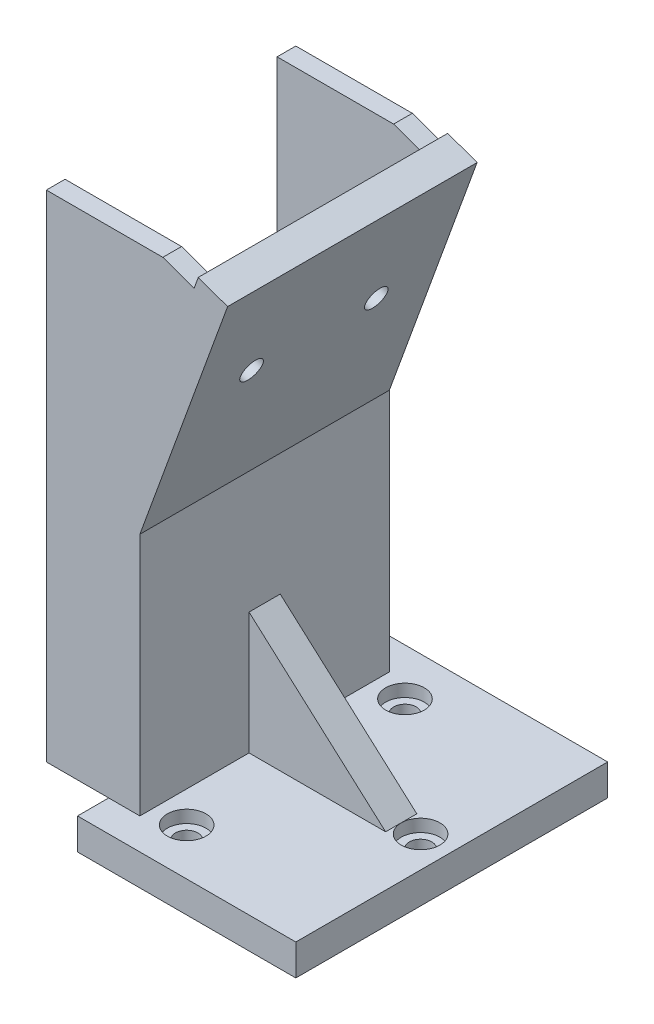
from build123d import *

# Parameters (mm, degrees)
SKETCH_2_W          = 5
SKETCH_2_H          = 40
CUT_EXTRUDE_1_REACH = 90.301
SKETCH_3_R          = 1.8
SKETCH_6_W          = 30
SKETCH_6_H          = 40
EXTRUDE_1_DEPTH     = 5
CUT_EXTRUDE_2_REACH = 95.593
SKETCH_8_R          = 1.8
SKETCH_9_W          = 35
SKETCH_9_H          = 5
EXTRUDE_2_DEPTH     = 5
SKETCH_10_R         = 3.1
CUT_EXTRUDE_3_DEPTH = 2
SKETCH_11_R         = 3.1
CUT_EXTRUDE_4_DEPTH = 2
EXTRUDE_4_DEPTH     = 3
RIB_5_REACH         = 96.788
SKETCH_21_WALL_W    = 220.937961122
SKETCH_21_WALL_H    = 5


with BuildPart() as part:
    # 扫描1: sweep along a path in 草图1
    with BuildLine(Plane.XY) as sweep_1_path:
        Line((0, 0), (0, 45))
        Line((0, 45), (14.36484602, 84.467090073))
    # 草图2 → 扫描1 (sweep)
    with BuildSketch(Plane(origin=(0, 0, 0), x_dir=(1, 0, 0), z_dir=(0, 1, 0))):
        with Locations((2.5, 0)):
            Rectangle(SKETCH_2_W, SKETCH_2_H)
    sweep(path=sweep_1_path.line, transition=Transition.RIGHT)

    # 草图3 → 切除-拉伸1 (cut, up to next)
    with BuildSketch(Plane(origin=(-14.462721218, 5.26400003, 0), x_dir=(0, 0, 1), z_dir=(-0.9396926207859081, 0.3420201433256695, 0)), mode=Mode.PRIVATE) as cut_extrude_1_sk1:
        with Locations(Location((-10, 66.286167935, 0), (0, 0, 270))):
            Circle(SKETCH_3_R)
    cut_extrude_1_tool1 = extrude(cut_extrude_1_sk1.sketch, amount=-CUT_EXTRUDE_1_REACH, mode=Mode.PRIVATE) & part.part
    # 草图3 → 切除-拉伸1 (cut, up to next)
    with BuildSketch(Plane(origin=(-14.462721218, 5.26400003, 0), x_dir=(0, 0, 1), z_dir=(-0.9396926207859081, 0.3420201433256695, 0)), mode=Mode.PRIVATE) as cut_extrude_1_sk2:
        with Locations(Location((10, 66.286167935, 0), (0, 0, 270))):
            Circle(SKETCH_3_R)
    cut_extrude_1_tool2 = extrude(cut_extrude_1_sk2.sketch, amount=-CUT_EXTRUDE_1_REACH, mode=Mode.PRIVATE) & part.part
    add(cut_extrude_1_tool1.solids().sort_by_distance((8.208483, 67.552623, -10))[0], mode=Mode.SUBTRACT)
    add(cut_extrude_1_tool2.solids().sort_by_distance((8.208483, 67.552623, 10))[0], mode=Mode.SUBTRACT)

    # 草图6 → 凸台-拉伸1 (add)
    with BuildSketch(Plane.XZ):
        with Locations((20, 0)):
            Rectangle(SKETCH_6_W, SKETCH_6_H)
    extrude(amount=-EXTRUDE_1_DEPTH)

    # 草图8 → 切除-拉伸2 (cut, up to next)
    with BuildSketch(Plane.XZ, mode=Mode.PRIVATE) as cut_extrude_2_sk1:
        with Locations(Location((10, 17.5, 0), (0, 0, 270))):
            Circle(SKETCH_8_R)
    cut_extrude_2_tool1 = extrude(cut_extrude_2_sk1.sketch, amount=-CUT_EXTRUDE_2_REACH, mode=Mode.PRIVATE) & part.part
    # 草图8 → 切除-拉伸2 (cut, up to next)
    with BuildSketch(Plane.XZ, mode=Mode.PRIVATE) as cut_extrude_2_sk2:
        with Locations(Location((10, -17.5, 0), (0, 0, 270))):
            Circle(SKETCH_8_R)
    cut_extrude_2_tool2 = extrude(cut_extrude_2_sk2.sketch, amount=-CUT_EXTRUDE_2_REACH, mode=Mode.PRIVATE) & part.part
    # 草图8 → 切除-拉伸2 (cut, up to next)
    with BuildSketch(Plane.XZ, mode=Mode.PRIVATE) as cut_extrude_2_sk3:
        with Locations(Location((30, 0, 0), (0, 0, 270))):
            Circle(SKETCH_8_R)
    cut_extrude_2_tool3 = extrude(cut_extrude_2_sk3.sketch, amount=-CUT_EXTRUDE_2_REACH, mode=Mode.PRIVATE) & part.part
    add(cut_extrude_2_tool1.solids().sort_by_distance((10, 0, 17.5))[0], mode=Mode.SUBTRACT)
    add(cut_extrude_2_tool2.solids().sort_by_distance((10, 0, -17.5))[0], mode=Mode.SUBTRACT)
    add(cut_extrude_2_tool3.solids().sort_by_distance((30, 0, 0))[0], mode=Mode.SUBTRACT)

    # 草图9 → 凸台-拉伸2 (add)
    with BuildSketch(Plane.XZ):
        with Locations((17.5, 22.5)):
            Rectangle(SKETCH_9_W, SKETCH_9_H)
        with Locations((17.5, -22.5)):
            Rectangle(SKETCH_9_W, SKETCH_9_H)
    extrude(amount=-EXTRUDE_2_DEPTH)

    # 草图10 → 切除-拉伸3 (cut)
    with BuildSketch(Plane(origin=(0, 5, 0), x_dir=(1, 0, 0), z_dir=(0, 1, 0))):
        with Locations(Location((10, -17.5, 0), (0, 0, 270))):
            Circle(SKETCH_10_R)
        with Locations(Location((10, 17.5, 0), (0, 0, 270))):
            Circle(SKETCH_10_R)
        with Locations(Location((30, 0, 0), (0, 0, 270))):
            Circle(SKETCH_10_R)
    extrude(amount=-CUT_EXTRUDE_3_DEPTH, mode=Mode.SUBTRACT)

    # 草图11 → 切除-拉伸4 (cut)
    with BuildSketch(Plane(origin=(-14.462721218, 5.26400003, 0), x_dir=(0, 0, 1), z_dir=(-0.9396926207859081, 0.3420201433256695, 0))):
        with Locations(Location((-10, 66.286167935, 0), (0, 0, 270))):
            Circle(SKETCH_11_R)
        with Locations(Location((10, 66.286167935, 0), (0, 0, 270))):
            Circle(SKETCH_11_R)
    extrude(amount=-CUT_EXTRUDE_4_DEPTH, mode=Mode.SUBTRACT)

    # 草图15 → 凸台-拉伸4 (add)
    with BuildSketch(Plane(origin=(0, 0, -20), x_dir=(-1, 0, 0), z_dir=(0, 0, -1))):
        Polygon((-8.680805733, 84.407556003), (-13.680805733, 82.587704831), (0, 45), (0, 5), (10, 5), (10, 84.407556003), align=None)
    extrude_4 = extrude(amount=-EXTRUDE_4_DEPTH)

    # 镜向2: 凸台-拉伸4 across plane
    add(extrude_4.mirror(Plane(origin=(0, 0, 0), x_dir=(1, 0, 0), z_dir=(0, 0, -1))))

    # 草图21 wall → 筋5 (add, up to next)
    with BuildSketch(Plane(origin=(15.95, 14.779591274, 0), x_dir=(0.745842716131, -0.666122093009, 0), z_dir=(-0.666122093009, -0.745842716131, 0)), mode=Mode.PRIVATE) as rib_5_sk1:
        Rectangle(SKETCH_21_WALL_W, SKETCH_21_WALL_H)
    rib_5_tool1 = extrude(rib_5_sk1.sketch, amount=RIB_5_REACH, mode=Mode.PRIVATE) - part.part
    add(rib_5_tool1.solids().sort_by_distance((15.95, 14.779591274, 0))[0])


solid = part.part
